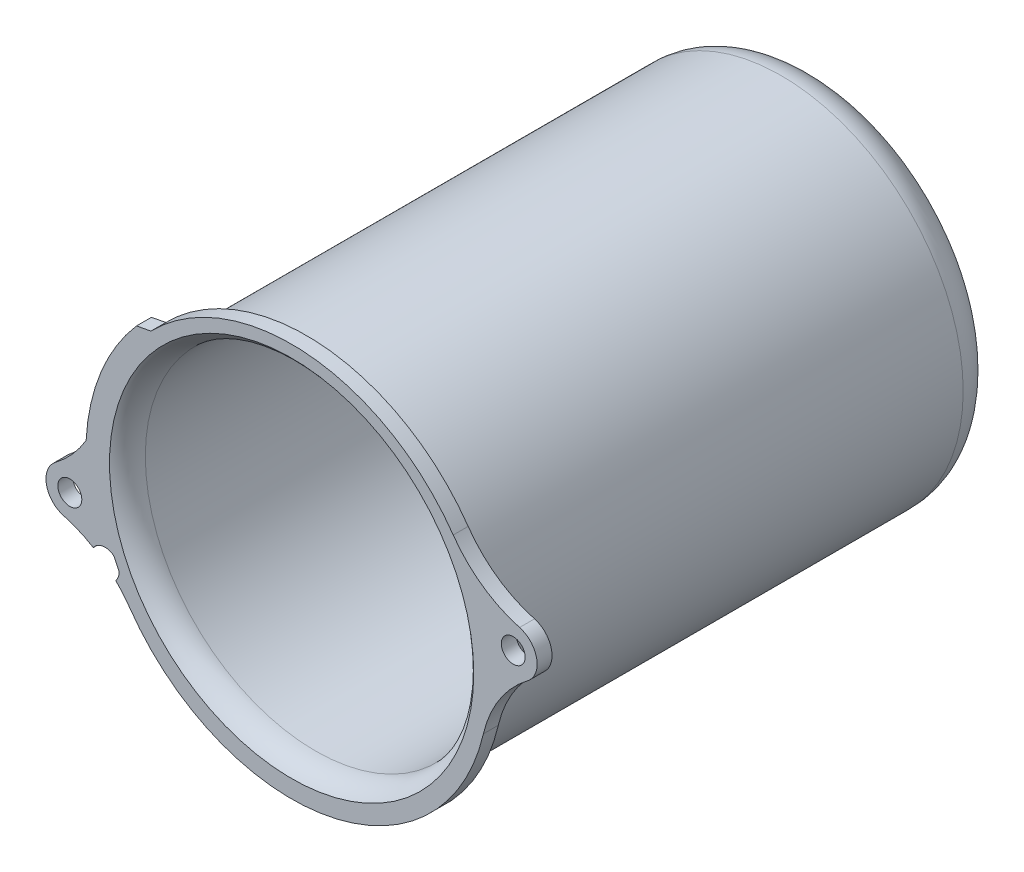
from build123d import *

# Parameters (mm, degrees)
ESQUISSE1_R          = 2
ESQUISSE1_R_2        = 31
BASE_EXTRUSION_DEPTH = 2.5


with BuildPart() as part:
    # Esquisse1 → Base-Extrusion (new body)
    with BuildSketch(Plane.XY):
        with BuildLine():
            Line((-23.568944799, 23.127218564), (-25.985846252, 22.667877672))
            ThreePointArc((-25.985846252, 22.667877672), (-31.952769274, 12.958758057), (-34.427057727, 1.834502094))
            ThreePointArc((-34.427057727, 1.834502094), (-36.71757785, -1.293387212), (-39.568531836, -3.92059777))
            ThreePointArc((-39.568531836, -3.92059777), (-41.084060438, -7.864835035), (-38.216117979, -10.967856241))
            ThreePointArc((-38.216117979, -10.967856241), (-35.643038141, -11.867938679), (-33.216253112, -13.109551613))
            ThreePointArc((-33.216253112, -13.109551613), (-29.807541742, -12.575727534), (-29.476662294, -16.010083389))
            ThreePointArc((-29.476662294, -16.010083389), (-28.22354999, -17.365107393), (-27.100684434, -18.829878173))
            ThreePointArc((-27.100684434, -18.829878173), (6.207299265, -32.391490341), (32.128854282, -7.463351859))
            ThreePointArc((32.128854282, -7.463351859), (34.835063313, -1.103826958), (39.544287655, 3.954861646))
            ThreePointArc((39.544287655, 3.954861646), (41.059816258, 7.899098911), (38.191873799, 11.002120117))
            ThreePointArc((38.191873799, 11.002120117), (31.944567964, 13.958180686), (27.076440254, 18.86414205))
            ThreePointArc((27.076440254, 18.86414205), (2.755864824, 32.900839887), (-23.568944799, 23.127218564))
        make_face()
        with Locations(Location((-37.155742586, -7.11096578, 0), (0, 0, 180))):
            Circle(ESQUISSE1_R, mode=Mode.SUBTRACT)
        with Locations((-0.01212209, 0.017131938)):
            Circle(ESQUISSE1_R_2, mode=Mode.SUBTRACT)
        with Locations((37.131498406, 7.145229656)):
            Circle(ESQUISSE1_R, mode=Mode.SUBTRACT)
    extrude(amount=BASE_EXTRUSION_DEPTH)

    # Esquisse2 → Boss.-Révol.2 (revolve)
    with BuildSketch(Plane(origin=(0, 0, 0), x_dir=(0, 0, -1), z_dir=(1, 0, 0)), mode=Mode.PRIVATE) as boss_r_vol_2_sk:
        with BuildLine():
            Line((0, 32.5), (0, 33))
            Line((0, 33), (-2.5, 33))
            Line((-2.5, 33), (-2.5, 31))
            ThreePointArc((-2.5, 31), (-0.736067977, 29.527864045), (1.5, 29))
            Line((1.5, 29), (79.5, 29))
            ThreePointArc((79.5, 29), (82.328427125, 27.828427125), (83.5, 25))
            Line((83.5, 25), (83.5, 13.5))
            ThreePointArc((83.5, 13.5), (83.856617963, 12.081362835), (84.841687605, 11))
            Line((84.841687605, 11), (91.5, 11))
            Line((91.5, 11), (91.5, 10.232050808))
            ThreePointArc((91.5, 10.232050808), (92.232050808, 9.5), (92.5, 8.5))
            Line((92.5, 8.5), (92.5, 0.5))
            Line((92.5, 0.5), (94.5, 0.5))
            Line((94.5, 0.5), (94.5, 8.5))
            ThreePointArc((94.5, 8.5), (93.328427125, 11.328427125), (90.5, 12.5))
            Line((90.5, 12.5), (86.5, 12.5))
            ThreePointArc((86.5, 12.5), (85.792893219, 12.792893219), (85.5, 13.5))
            Line((85.5, 13.5), (85.5, 25))
            ThreePointArc((85.5, 25), (83.742640687, 29.242640687), (79.5, 31))
            Line((79.5, 31), (1.5, 31))
            ThreePointArc((1.5, 31), (0.439339828, 31.439339828), (0, 32.5))
        make_face()
    revolve(boss_r_vol_2_sk.sketch.rotate(Axis((0, 0.49, -0.231281164), (0, 0, -1)), 90), axis=Axis((0, 0.49, -0.231281164), (0, 0, -1)))


solid = part.part
